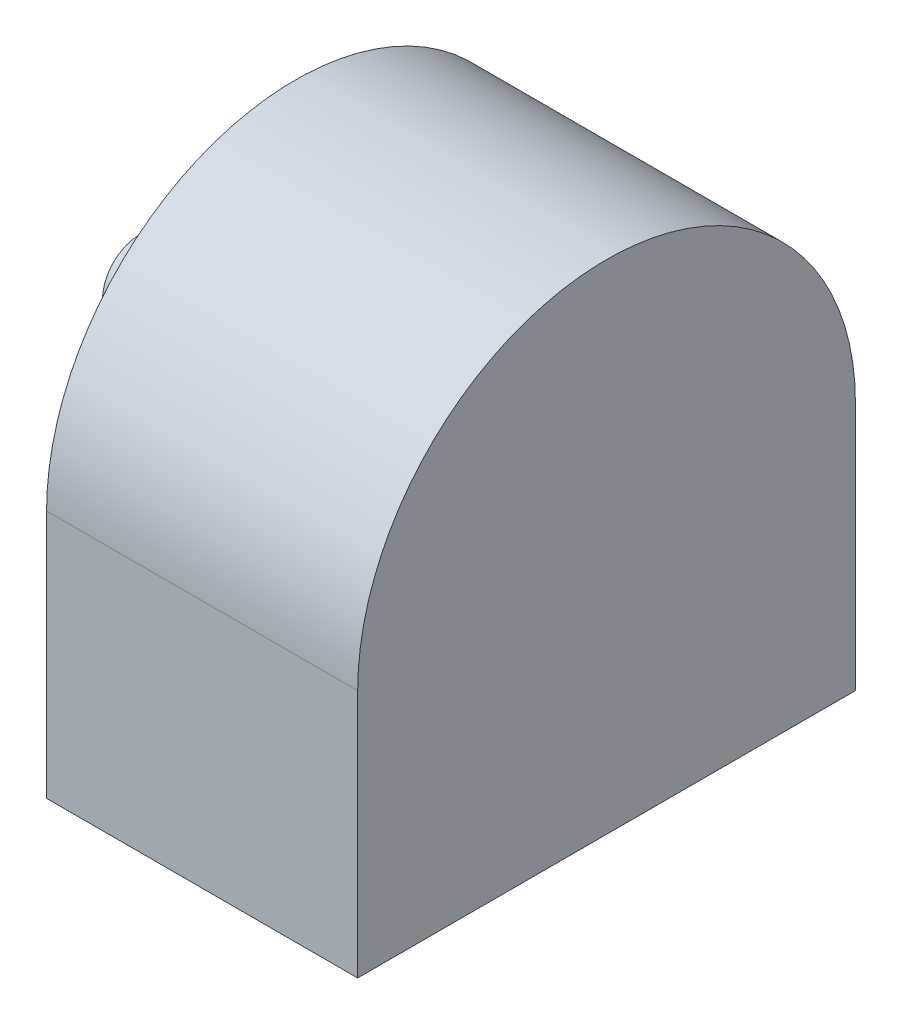
from build123d import *

# Parameters (mm, degrees)
SKETCH3_W           = 160
SKETCH3_H           = 80
BOSS_EXTRUDE1_DEPTH = 100
SKETCH5_R           = 12.5
CUT_EXTRUDE2_DEPTH  = 50


with BuildPart() as part:
    # Sketch1 → Revolve1 (revolve)
    with BuildSketch(Plane.XY):
        Polygon((0, 0), (-150, 0), (-150, 12), (-100, 12), (-100, 80), (0, 80), align=None)
    revolve(axis=Axis((0, 0, 0), (-1, 0, 0)))

    # Sketch3 → Boss-Extrude1 (add)
    with BuildSketch(Plane(origin=(0, 0, 0), x_dir=(0, 0, -1), z_dir=(1, 0, 0))):
        with Locations((0, -40)):
            Rectangle(SKETCH3_W, SKETCH3_H)
    extrude(amount=-BOSS_EXTRUDE1_DEPTH)

    # Sketch5 → Cut-Extrude2 (cut)
    with BuildSketch(Plane.XZ.offset(80)):
        with Locations((-50, 54.694760198)):
            Circle(SKETCH5_R)
        with Locations((-50, -65.305239802)):
            Circle(SKETCH5_R)
    extrude(amount=-CUT_EXTRUDE2_DEPTH, mode=Mode.SUBTRACT)


solid = part.part
